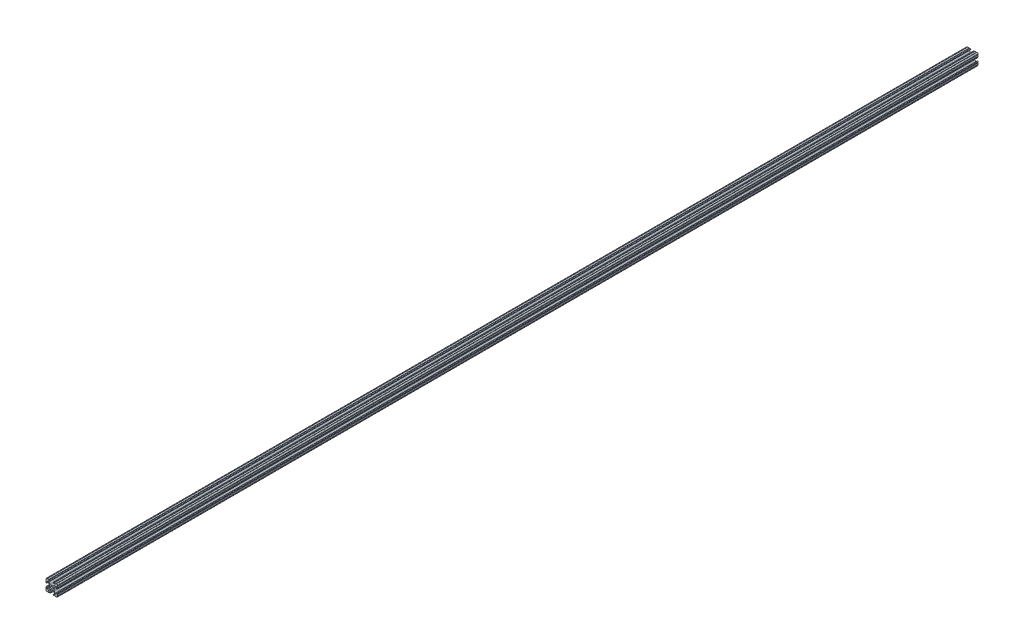
from build123d import *

# Parameters (mm, degrees)
SKETCH1_R      = 2.6035
EXTRUDE1_DEPTH = 2032


with BuildPart() as part:
    # Sketch1 → Extrude1 (new body)
    with BuildSketch(Plane.XY):
        with BuildLine():
            Line((-7.207036008, 8.724370562), (-3.898272566, 5.423169045))
            ThreePointArc((-3.898272566, 5.423169045), (-2.869120213, 4.736787962), (-1.655778399, 4.4958))
            Line((-1.655778399, 4.4958), (1.655778399, 4.4958))
            ThreePointArc((1.655778399, 4.4958), (2.869120213, 4.736787962), (3.898272566, 5.423169045))
            Line((3.898272566, 5.423169045), (7.207036008, 8.724370562))
            ThreePointArc((7.207036008, 8.724370562), (7.432222385, 9.85140422), (6.476788598, 10.4902))
            Line((6.476788598, 10.4902), (4.287512407, 10.4902))
            ThreePointArc((4.287512407, 10.4902), (3.54574862, 10.79744862), (3.2385, 11.539212407))
            Line((3.2385, 11.539212407), (3.2385, 11.650987593))
            ThreePointArc((3.2385, 11.650987593), (3.54574862, 12.39275138), (4.287512407, 12.7))
            Line((4.287512407, 12.7), (5.317126718, 12.7))
            ThreePointArc((5.317126718, 12.7), (5.825126718, 12.192), (6.333126718, 12.7))
            Line((6.333126718, 12.7), (9.550443118, 12.7))
            ThreePointArc((9.550443118, 12.7), (10.058366869, 12.192000006), (10.566443095, 12.699847501))
            ThreePointArc((10.566443095, 12.699847501), (12.082537762, 12.08250727), (12.699846982, 10.566399977))
            ThreePointArc((12.699846982, 10.566399977), (12.192000006, 10.058323491), (12.7, 9.5504))
            Line((12.7, 9.5504), (12.7, 6.3330836))
            ThreePointArc((12.7, 6.3330836), (12.192, 5.8250836), (12.7, 5.3170836))
            Line((12.7, 5.3170836), (12.7, 4.287469289))
            ThreePointArc((12.7, 4.287469289), (12.39275138, 3.545705502), (11.650987593, 3.238456882))
            Line((11.650987593, 3.238456882), (11.539212407, 3.238456882))
            ThreePointArc((11.539212407, 3.238456882), (10.79744862, 3.545705502), (10.4902, 4.287469289))
            Line((10.4902, 4.287469289), (10.4902, 6.402089023))
            ThreePointArc((10.4902, 6.402089023), (9.856505071, 7.351067942), (8.737131347, 7.129408934))
            Line((8.737131347, 7.129408934), (5.441005833, 3.840816462))
            ThreePointArc((5.441005833, 3.840816462), (4.750877967, 2.809883091), (4.5085, 1.593185507))
            Line((4.5085, 1.593185507), (4.5085, -1.593185507))
            ThreePointArc((4.5085, -1.593185507), (4.750877967, -2.809883091), (5.441005833, -3.840816462))
            Line((5.441005833, -3.840816462), (8.737131347, -7.129408934))
            ThreePointArc((8.737131347, -7.129408934), (9.856505071, -7.351067942), (10.4902, -6.402089023))
            Line((10.4902, -6.402089023), (10.4902, -4.287469289))
            ThreePointArc((10.4902, -4.287469289), (10.79744862, -3.545705502), (11.539212407, -3.238456882))
            Line((11.539212407, -3.238456882), (11.650987593, -3.238456882))
            ThreePointArc((11.650987593, -3.238456882), (12.39275138, -3.545705502), (12.7, -4.287469289))
            Line((12.7, -4.287469289), (12.7, -5.3170836))
            ThreePointArc((12.7, -5.3170836), (12.192, -5.8250836), (12.7, -6.3330836))
            Line((12.7, -6.3330836), (12.7, -9.5504))
            ThreePointArc((12.7, -9.5504), (12.192000006, -10.058323491), (12.699846982, -10.566399977))
            ThreePointArc((12.699846982, -10.566399977), (12.082537762, -12.08250727), (10.566443095, -12.699847501))
            ThreePointArc((10.566443095, -12.699847501), (10.058366869, -12.192000006), (9.550443118, -12.7))
            Line((9.550443118, -12.7), (6.333126718, -12.7))
            ThreePointArc((6.333126718, -12.7), (5.825126718, -12.192), (5.317126718, -12.7))
            Line((5.317126718, -12.7), (4.287512407, -12.7))
            ThreePointArc((4.287512407, -12.7), (3.54574862, -12.39275138), (3.2385, -11.650987593))
            Line((3.2385, -11.650987593), (3.2385, -11.539212407))
            ThreePointArc((3.2385, -11.539212407), (3.54574862, -10.79744862), (4.287512407, -10.4902))
            Line((4.287512407, -10.4902), (6.416408329, -10.4902))
            ThreePointArc((6.416408329, -10.4902), (7.41473083, -9.822813117), (7.179650497, -8.645192506))
            Line((7.179650497, -8.645192506), (3.952270251, -5.423690499))
            ThreePointArc((3.952270251, -5.423690499), (2.922936451, -4.736929036), (1.709253557, -4.4958))
            Line((1.709253557, -4.4958), (-1.709253557, -4.4958))
            ThreePointArc((-1.709253557, -4.4958), (-2.922936451, -4.736929036), (-3.952270251, -5.423690499))
            Line((-3.952270251, -5.423690499), (-7.179650497, -8.645192506))
            ThreePointArc((-7.179650497, -8.645192506), (-7.41473083, -9.822813117), (-6.416408329, -10.4902))
            Line((-6.416408329, -10.4902), (-4.287512407, -10.4902))
            ThreePointArc((-4.287512407, -10.4902), (-3.54574862, -10.79744862), (-3.2385, -11.539212407))
            Line((-3.2385, -11.539212407), (-3.2385, -11.650987593))
            ThreePointArc((-3.2385, -11.650987593), (-3.54574862, -12.39275138), (-4.287512407, -12.7))
            Line((-4.287512407, -12.7), (-5.317126718, -12.7))
            ThreePointArc((-5.317126718, -12.7), (-5.825126718, -12.192), (-6.333126718, -12.7))
            Line((-6.333126718, -12.7), (-9.550443118, -12.7))
            ThreePointArc((-9.550443118, -12.7), (-10.058366869, -12.192000006), (-10.566443095, -12.699847501))
            ThreePointArc((-10.566443095, -12.699847501), (-12.082537762, -12.08250727), (-12.699846982, -10.566399977))
            ThreePointArc((-12.699846982, -10.566399977), (-12.192000006, -10.058323491), (-12.7, -9.5504))
            Line((-12.7, -9.5504), (-12.7, -6.3330836))
            ThreePointArc((-12.7, -6.3330836), (-12.192, -5.8250836), (-12.7, -5.3170836))
            Line((-12.7, -5.3170836), (-12.7, -4.287469289))
            ThreePointArc((-12.7, -4.287469289), (-12.39275138, -3.545705502), (-11.650987593, -3.238456882))
            Line((-11.650987593, -3.238456882), (-11.539212407, -3.238456882))
            ThreePointArc((-11.539212407, -3.238456882), (-10.79744862, -3.545705502), (-10.4902, -4.287469289))
            Line((-10.4902, -4.287469289), (-10.4902, -6.402089023))
            ThreePointArc((-10.4902, -6.402089023), (-9.856505071, -7.351067942), (-8.737131347, -7.129408934))
            Line((-8.737131347, -7.129408934), (-5.441005833, -3.840816462))
            ThreePointArc((-5.441005833, -3.840816462), (-4.750877967, -2.809883091), (-4.5085, -1.593185507))
            Line((-4.5085, -1.593185507), (-4.5085, 1.593185507))
            ThreePointArc((-4.5085, 1.593185507), (-4.750877967, 2.809883091), (-5.441005833, 3.840816462))
            Line((-5.441005833, 3.840816462), (-8.737131347, 7.129408934))
            ThreePointArc((-8.737131347, 7.129408934), (-9.856505071, 7.351067942), (-10.4902, 6.402089023))
            Line((-10.4902, 6.402089023), (-10.4902, 4.287469289))
            ThreePointArc((-10.4902, 4.287469289), (-10.79744862, 3.545705502), (-11.539212407, 3.238456882))
            Line((-11.539212407, 3.238456882), (-11.650987593, 3.238456882))
            ThreePointArc((-11.650987593, 3.238456882), (-12.39275138, 3.545705502), (-12.7, 4.287469289))
            Line((-12.7, 4.287469289), (-12.7, 5.3170836))
            ThreePointArc((-12.7, 5.3170836), (-12.192, 5.8250836), (-12.7, 6.3330836))
            Line((-12.7, 6.3330836), (-12.7, 9.5504))
            ThreePointArc((-12.7, 9.5504), (-12.192000006, 10.058323491), (-12.699846982, 10.566399977))
            ThreePointArc((-12.699846982, 10.566399977), (-12.082537762, 12.08250727), (-10.566443095, 12.699847501))
            ThreePointArc((-10.566443095, 12.699847501), (-10.058366869, 12.192000006), (-9.550443118, 12.7))
            Line((-9.550443118, 12.7), (-6.333126718, 12.7))
            ThreePointArc((-6.333126718, 12.7), (-5.825126718, 12.192), (-5.317126718, 12.7))
            Line((-5.317126718, 12.7), (-4.287512407, 12.7))
            ThreePointArc((-4.287512407, 12.7), (-3.54574862, 12.39275138), (-3.2385, 11.650987593))
            Line((-3.2385, 11.650987593), (-3.2385, 11.539212407))
            ThreePointArc((-3.2385, 11.539212407), (-3.54574862, 10.79744862), (-4.287512407, 10.4902))
            Line((-4.287512407, 10.4902), (-6.476788598, 10.4902))
            ThreePointArc((-6.476788598, 10.4902), (-7.432222385, 9.85140422), (-7.207036008, 8.724370562))
        make_face()
        Circle(SKETCH1_R, mode=Mode.SUBTRACT)
    extrude(amount=-EXTRUDE1_DEPTH)


solid = part.part
